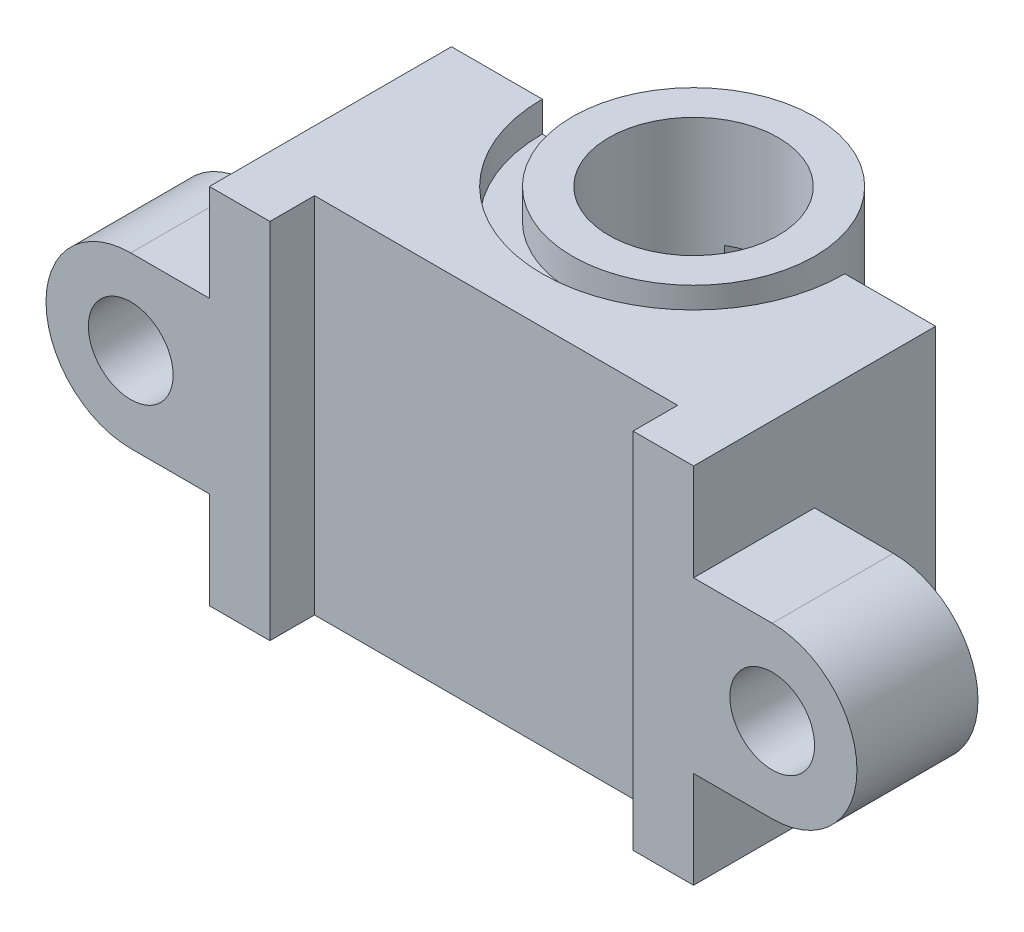
from build123d import *

# Parameters (mm, degrees)
SKETCH1_W           = 80
SKETCH1_H           = 60
BOSS_EXTRUDE1_DEPTH = 40
SKETCH2_W           = 60
SKETCH2_H           = 7.368056933
CUT_EXTRUDE1_DEPTH  = 83.462112512
BOSS_EXTRUDE2_DEPTH = 20
SKETCH5_R           = 7
CUT_EXTRUDE2_DEPTH  = 77.085478247
SKETCH6_R           = 25
CUT_EXTRUDE3_DEPTH  = 5
SKETCH7_R           = 20
BOSS_EXTRUDE3_DEPTH = 55
SKETCH8_R           = 14
CUT_EXTRUDE4_DEPTH  = 106.422957652
SKETCH11_W          = 14
SKETCH11_H          = 14
CUT_EXTRUDE5_DEPTH  = 10


with BuildPart() as part:
    # Sketch1 → Boss-Extrude1 (new body)
    with BuildSketch(Plane.XY):
        Rectangle(SKETCH1_W, SKETCH1_H)
    extrude(amount=-BOSS_EXTRUDE1_DEPTH)

    # Sketch2 → Cut-Extrude1 (cut, through all)
    with BuildSketch(Plane(origin=(0, 30, 0), x_dir=(1, 0, 0), z_dir=(0, 1, 0))):
        with Locations((0, 3.684028467)):
            Rectangle(SKETCH2_W, SKETCH2_H)
    extrude(amount=-CUT_EXTRUDE1_DEPTH, mode=Mode.SUBTRACT)

    # Sketch4 → Boss-Extrude2 (add)
    with BuildSketch(Plane.XY):
        with BuildLine():
            Line((40, -14), (53, -14))
            ThreePointArc((53, -14), (67, 0), (53, 14))
            Line((53, 14), (40, 14))
            Line((40, 14), (40, -14))
        make_face()
    boss_extrude2 = extrude(amount=-BOSS_EXTRUDE2_DEPTH)

    # Sketch5 → Cut-Extrude2 (cut, through all)
    with BuildSketch(Plane(origin=(0, 0, -20), x_dir=(-1, 0, 0), z_dir=(0, 0, -1))):
        with Locations((-53, 0)):
            Circle(SKETCH5_R)
    cut_extrude2 = extrude(amount=-CUT_EXTRUDE2_DEPTH, mode=Mode.SUBTRACT)

    # Mirror1: Boss-Extrude2, Cut-Extrude2 across plane
    add(boss_extrude2.mirror(Plane(origin=(0, 0, 0), x_dir=(0, 0, 1), z_dir=(1, 0, 0))))
    add(cut_extrude2.mirror(Plane(origin=(0, 0, 0), x_dir=(0, 0, 1), z_dir=(1, 0, 0))), mode=Mode.SUBTRACT)

    # Sketch6 → Cut-Extrude3 (cut)
    with BuildSketch(Plane.XZ.offset(30)):
        with Locations((0, -40)):
            Circle(SKETCH6_R)
    cut_extrude3 = extrude(amount=-CUT_EXTRUDE3_DEPTH, mode=Mode.SUBTRACT)

    # Mirror2: Cut-Extrude3 across plane
    add(cut_extrude3.mirror(Plane.ZX), mode=Mode.SUBTRACT)

    # Sketch7 → Boss-Extrude3 (add, through all)
    with BuildSketch(Plane.XZ.offset(25)):
        with Locations(Location((0, -40, 0), (0, 0, 270))):
            Circle(SKETCH7_R)
    extrude(amount=-BOSS_EXTRUDE3_DEPTH)

    # Sketch8 → Cut-Extrude4 (cut, through all)
    with BuildSketch(Plane.XZ.offset(25)):
        with Locations(Location((0, -40, 0), (0, 0, 270))):
            Circle(SKETCH8_R)
    extrude(amount=-CUT_EXTRUDE4_DEPTH, mode=Mode.SUBTRACT)

    # Sketch11 → Cut-Extrude5 (cut)
    with BuildSketch(Plane.XY.offset(-60)):
        with Locations((0, 5)):
            Rectangle(SKETCH11_W, SKETCH11_H)
    extrude(amount=CUT_EXTRUDE5_DEPTH, mode=Mode.SUBTRACT)


solid = part.part
